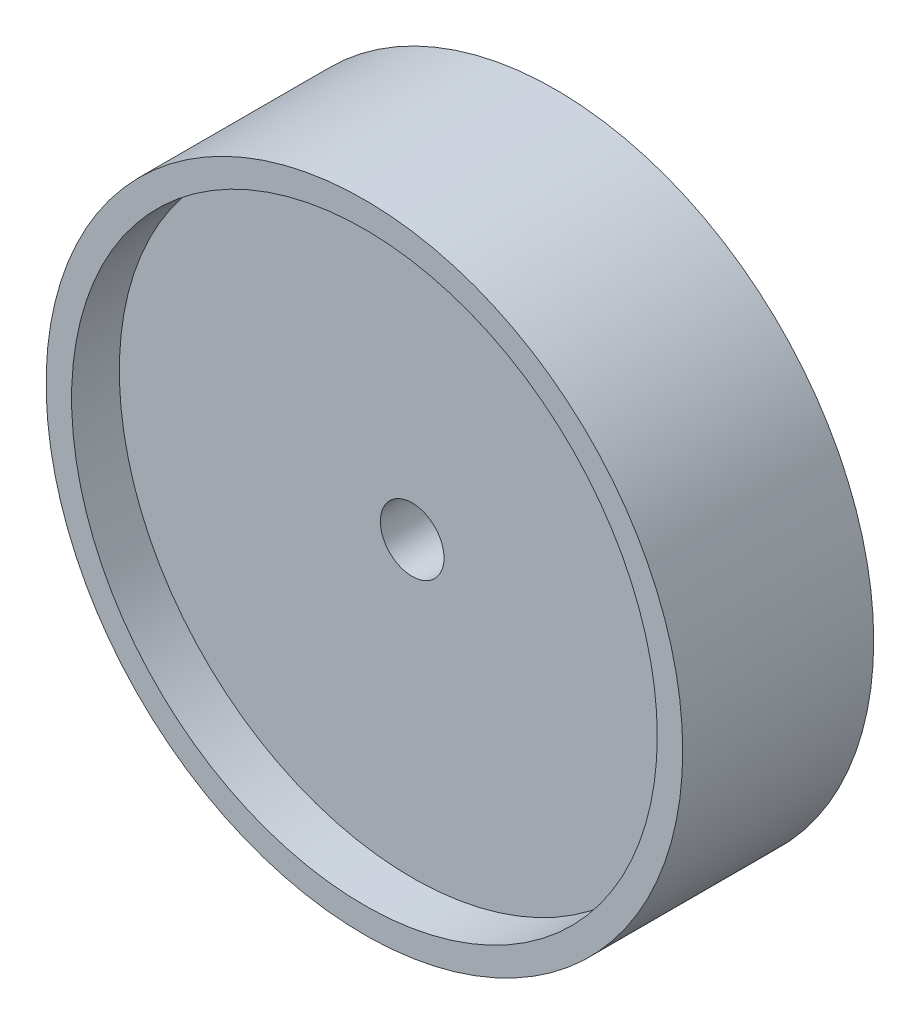
from build123d import *

# Parameters (mm, degrees)
SKETCH1_R                = 230
BOSS_EXTRUDE1_DEPTH      = 75
BOSS_EXTRUDE2_DEPTH      = 37.5
BOSS_EXTRUDE2_DEPTH_BACK = 112.5
SKETCH2_R                = 250
SKETCH2_R_2              = 230
SKETCH3_R                = 25
CUT_EXTRUDE1_DEPTH       = 372.020551991


with BuildPart() as part:
    # Sketch1 → Boss-Extrude1 (new body)
    with BuildSketch(Plane.XY):
        Circle(SKETCH1_R)
    extrude(amount=BOSS_EXTRUDE1_DEPTH)

    # Sketch3 → Cut-Extrude1 (cut, through all)
    with BuildSketch(Plane.XY.offset(75)):
        Circle(SKETCH3_R)
    extrude(amount=-CUT_EXTRUDE1_DEPTH, mode=Mode.SUBTRACT)


with BuildPart() as body_2:
    # Sketch2 → Boss-Extrude2 (new, two sides: drawn at the far end of the back side and taken through both)
    with BuildSketch(Plane.XY.offset(75).offset(-BOSS_EXTRUDE2_DEPTH_BACK)):
        Circle(SKETCH2_R)
        Circle(SKETCH2_R_2, mode=Mode.SUBTRACT)
    extrude(amount=BOSS_EXTRUDE2_DEPTH + BOSS_EXTRUDE2_DEPTH_BACK)


solid = Compound([part.part, body_2.part])
